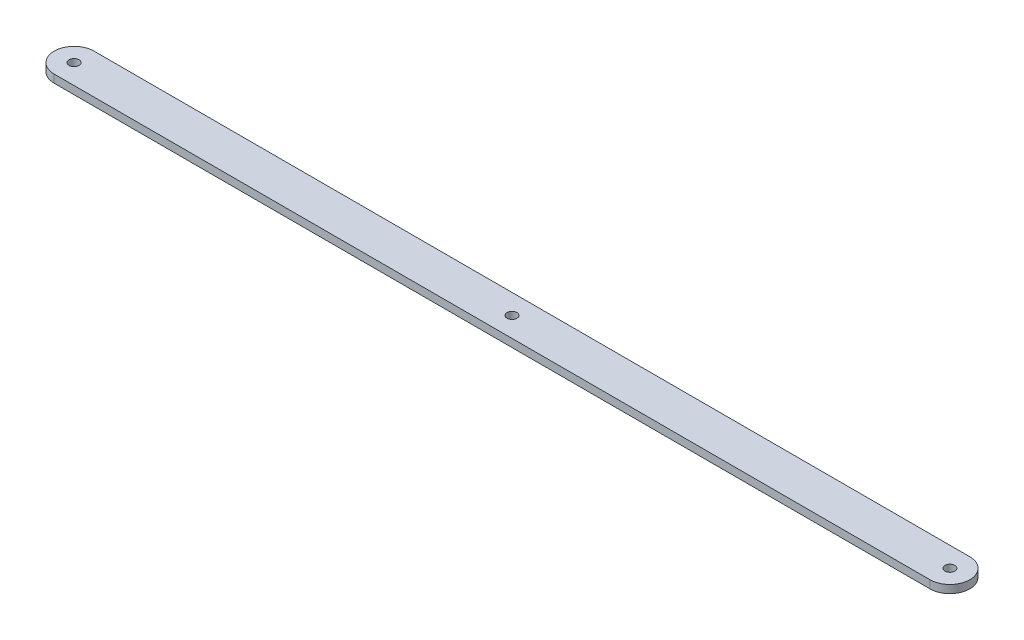
from build123d import *

# Parameters (mm, degrees)
SKETCH1_R           = 6.25
BOSS_EXTRUDE1_DEPTH = 10
SKETCH2_R           = 6.25
CUT_EXTRUDE1_DEPTH  = 576.630089554


with BuildPart() as part:
    # Sketch1 → Boss-Extrude1 (new body)
    with BuildSketch(Plane(origin=(0, 0, 0), x_dir=(1, 0, 0), z_dir=(0, 1, 0))):
        with BuildLine():
            Line((-550, 25), (550, 25))
            ThreePointArc((550, 25), (575, 0), (550, -25))
            Line((550, -25), (-550, -25))
            ThreePointArc((-550, -25), (-575, 0), (-550, 25))
        make_face()
        with Locations(Location((-550, 0, 0), (0, 0, 270))):
            Circle(SKETCH1_R, mode=Mode.SUBTRACT)
        with Locations(Location((550, 0, 0), (0, 0, 270))):
            Circle(SKETCH1_R, mode=Mode.SUBTRACT)
    extrude(amount=BOSS_EXTRUDE1_DEPTH)

    # Sketch2 → Cut-Extrude1 (cut, through all)
    with BuildSketch(Plane(origin=(0, 10, 0), x_dir=(1, 0, 0), z_dir=(0, 1, 0))):
        with Locations(Location((0, 0, 0), (0, 0, 270))):
            Circle(SKETCH2_R)
    extrude(amount=-CUT_EXTRUDE1_DEPTH, mode=Mode.SUBTRACT)


solid = part.part
